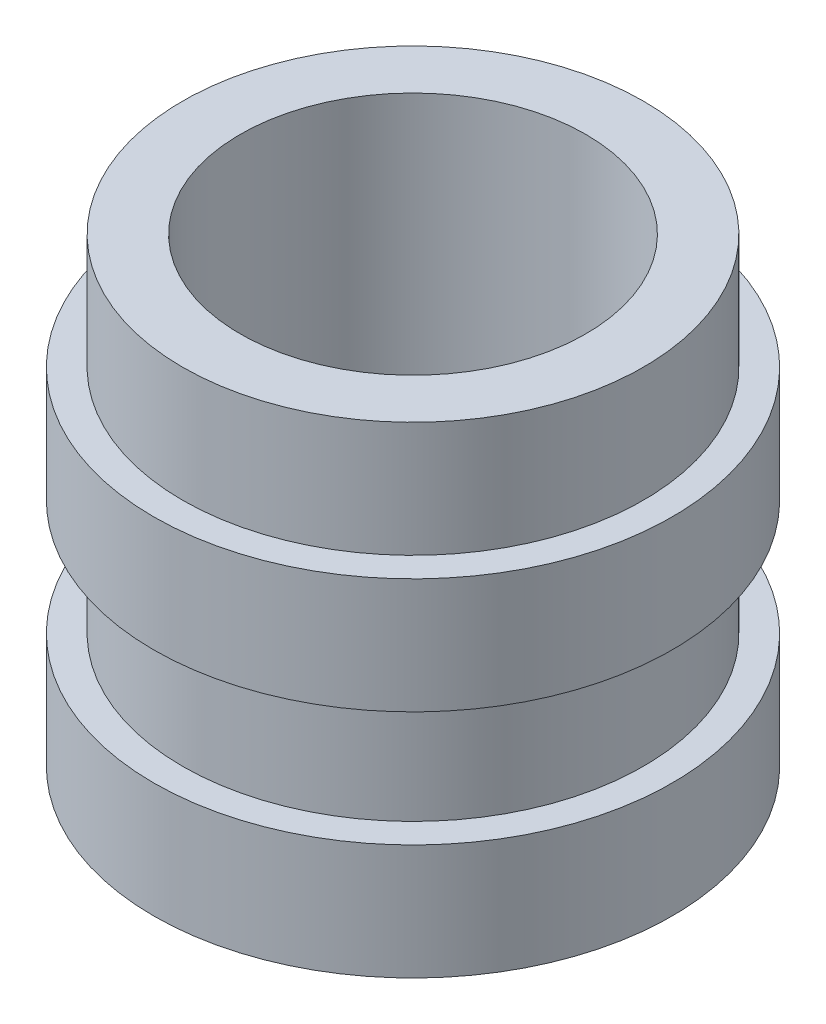
from build123d import *

# Parameters (mm, degrees)
SKETCH1_R           = 2
BOSS_EXTRUDE1_DEPTH = 1
SKETCH2_R           = 2.25
BOSS_EXTRUDE2_DEPTH = 1
BOSS_EXTRUDE3_START = 1
SKETCH3_R           = 2
BOSS_EXTRUDE3_DEPTH = 1
SKETCH4_R           = 2.25
BOSS_EXTRUDE4_DEPTH = 1
SKETCH5_R           = 1.5
CUT_EXTRUDE1_DEPTH  = 6.111262075


with BuildPart() as part:
    # Sketch1 → Boss-Extrude1 (new body)
    with BuildSketch(Plane(origin=(0, 0, 0), x_dir=(1, 0, 0), z_dir=(0, 1, 0))):
        with Locations(Location((0, 0, 0), (0, 0, 270))):
            Circle(SKETCH1_R)
    extrude(amount=BOSS_EXTRUDE1_DEPTH)

    # Sketch2 → Boss-Extrude2 (add)
    with BuildSketch(Plane.XZ):
        with Locations(Location((0, 0, 0), (0, 0, 270))):
            Circle(SKETCH2_R)
    extrude(amount=BOSS_EXTRUDE2_DEPTH)

    # Sketch3 → Boss-Extrude3 (add)
    with BuildSketch(Plane.XZ.offset(1).offset(BOSS_EXTRUDE3_START)):
        with Locations(Location((0, 0, 0), (0, 0, 90))):
            Circle(SKETCH3_R)
    extrude(amount=-BOSS_EXTRUDE3_DEPTH)

    # Sketch4 → Boss-Extrude4 (add)
    with BuildSketch(Plane.XZ.offset(2)):
        with Locations(Location((0, 0, 0), (0, 0, 270))):
            Circle(SKETCH4_R)
    extrude(amount=BOSS_EXTRUDE4_DEPTH)

    # Sketch5 → Cut-Extrude1 (cut, through all)
    with BuildSketch(Plane.XZ.offset(3)):
        with Locations(Location((0, 0, 0), (0, 0, 270))):
            Circle(SKETCH5_R)
    extrude(amount=-CUT_EXTRUDE1_DEPTH, mode=Mode.SUBTRACT)


solid = part.part
